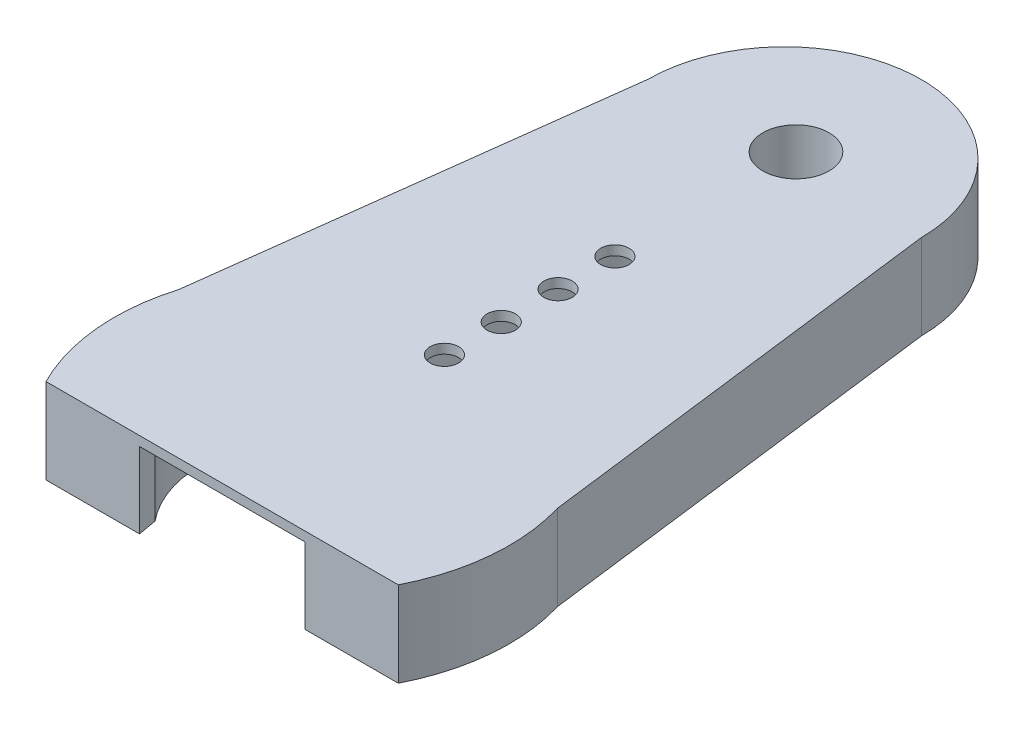
from build123d import *

# Parameters (mm, degrees)
DODANIE_WYCI_GNI_CIE1_DEPTH = 4
DODANIE_WYCI_GNI_CIE2_DEPTH = 0.5
WYTNIJ_WYCI_GNI_CIE6_DEPTH  = 4
WYTNIJ_WYCI_GNI_CIE7_DEPTH  = 10
SZKIC8_R                    = 1.75
WYTNIJ_WYCI_GNI_CIE8_DEPTH  = 10
SZKIC9_R                    = 0.75
WYTNIJ_WYCI_GNI_CIE9_DEPTH  = 10


with BuildPart() as part:
    # Szkic1 → Dodanie-wyciągnięcie1 (new body)
    with BuildSketch(Plane(origin=(0, 0, 0), x_dir=(1, 0, 0), z_dir=(0, 1, 0))):
        with BuildLine():
            Line((-7.225110555, 24.972122297), (-9.998428156, 2.972122297))
            ThreePointArc((-9.998428156, 2.972122297), (0, -10.430823387), (9.998428156, 2.972122297))
            Line((9.998428156, 2.972122297), (7.225110555, 24.972122297))
            ThreePointArc((7.225110555, 24.972122297), (0, 32.183793132), (-7.225110555, 24.972122297))
        make_face()
        with BuildLine():
            Line((-5.067752367, 2.972122297), (-3.003681195, 14.820995555))
            Line((-3.003681195, 14.820995555), (-2.892810316, 16.996498506))
            ThreePointArc((-2.892810316, 16.996498506), (0, 19.989966002), (2.892810316, 16.996498506))
            Line((2.892810316, 16.996498506), (2.962451003, 14.820995555))
            Line((2.962451003, 14.820995555), (5.067752367, 2.972122297))
            ThreePointArc((5.067752367, 2.972122297), (0, -5.875), (-5.067752367, 2.972122297))
        make_face(mode=Mode.SUBTRACT)
    extrude(amount=DODANIE_WYCI_GNI_CIE1_DEPTH)

    # Szkic2 → Dodanie-wyciągnięcie2 (add)
    with BuildSketch(Plane(origin=(0, 4, 0), x_dir=(1, 0, 0), z_dir=(0, 1, 0))):
        with BuildLine():
            Line((-7.225110555, 24.972122297), (-9.998428156, 2.972122297))
            ThreePointArc((-9.998428156, 2.972122297), (0, -10.430823387), (9.998428156, 2.972122297))
            Line((9.998428156, 2.972122297), (7.225110555, 24.972122297))
            ThreePointArc((7.225110555, 24.972122297), (0, 32.183793132), (-7.225110555, 24.972122297))
        make_face()
    extrude(amount=DODANIE_WYCI_GNI_CIE2_DEPTH)

    # Szkic5 → Wytnij-wyciągnięcie6 (cut)
    with BuildSketch(Plane.XZ):
        with BuildLine():
            Line((-2.212371502, 17.095463356), (2.237628498, 17.095463356))
            Line((2.237628498, 17.095463356), (4.534426812, 3.735585428))
            ThreePointArc((4.534426812, 3.735585428), (0.000881881, 5.874999934), (-4.53330513, 3.736946561))
            Line((-4.53330513, 3.736946561), (-2.212371502, 17.095463356))
        make_face()
    extrude(amount=-WYTNIJ_WYCI_GNI_CIE6_DEPTH, mode=Mode.SUBTRACT)

    # Szkic7 → Wytnij-wyciągnięcie7 (cut)
    with BuildSketch(Plane.XZ):
        with BuildLine():
            Line((-9.294248657, 4.73487259), (9.297326284, 4.728826547))
            ThreePointArc((9.297326284, 4.728826547), (0.003392139, 10.430822836), (-9.294248657, 4.73487259))
        make_face()
    extrude(amount=-WYTNIJ_WYCI_GNI_CIE7_DEPTH, mode=Mode.SUBTRACT)

    # Szkic8 → Wytnij-wyciągnięcie8 (cut)
    with BuildSketch(Plane.XZ):
        with Locations(Location((0, -25.563793132, 0), (0, 0, 270))):
            Circle(SZKIC8_R)
    extrude(amount=-WYTNIJ_WYCI_GNI_CIE8_DEPTH, mode=Mode.SUBTRACT)

    # Szkic9 → Wytnij-wyciągnięcie9 (cut)
    with BuildSketch(Plane.XZ.offset(-4)):
        with Locations(Location((0, -16.003793132, 0), (0, 0, 270))):
            Circle(SZKIC9_R)
        with Locations(Location((0, -13.003793132, 0), (0, 0, 270))):
            Circle(SZKIC9_R)
        with Locations(Location((0, -10.003793132, 0), (0, 0, 270))):
            Circle(SZKIC9_R)
        with Locations(Location((0, -7.003793132, 0), (0, 0, 270))):
            Circle(SZKIC9_R)
    extrude(amount=-WYTNIJ_WYCI_GNI_CIE9_DEPTH, mode=Mode.SUBTRACT)


solid = part.part
